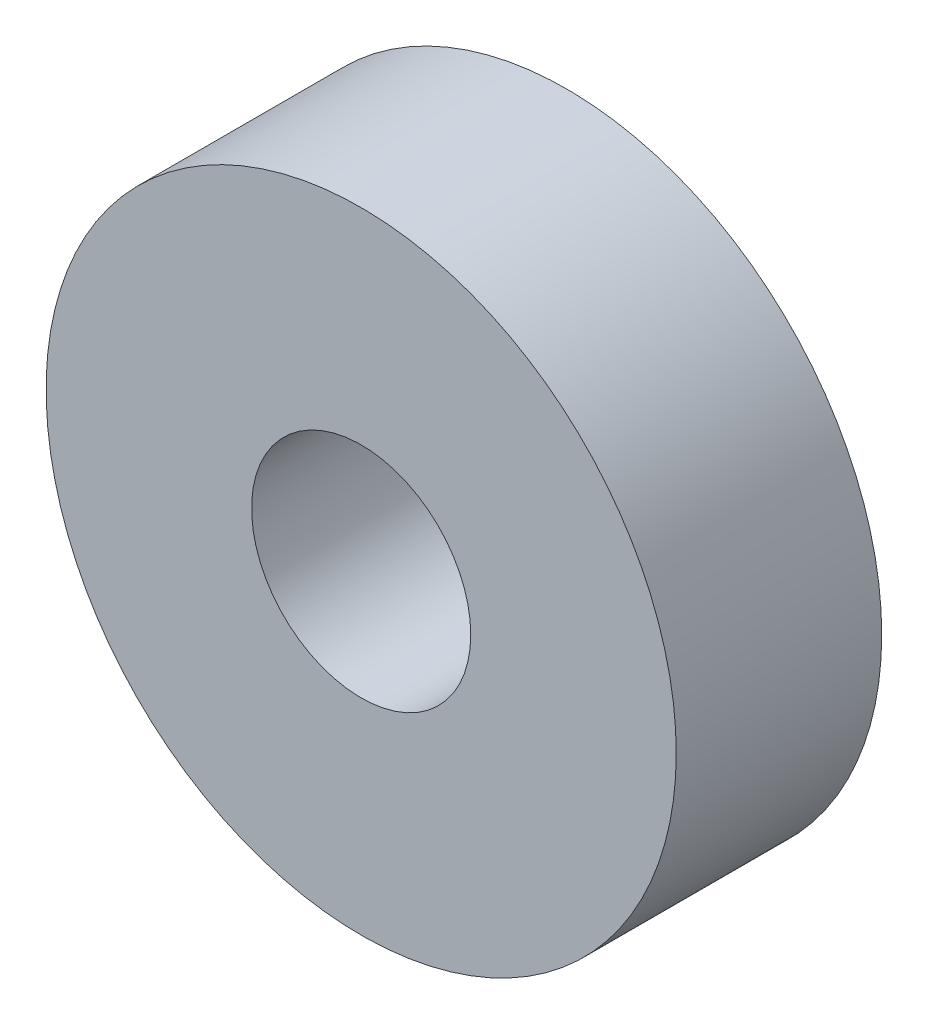
from build123d import *

# Parameters (mm, degrees)
SKETCH1_R           = 4.6
SKETCH1_R_2         = 1.6
BOSS_EXTRUDE1_DEPTH = 3


with BuildPart() as part:
    # Sketch1 → Boss-Extrude1 (new body)
    with BuildSketch(Plane.XY):
        Circle(SKETCH1_R)
        Circle(SKETCH1_R_2, mode=Mode.SUBTRACT)
    extrude(amount=BOSS_EXTRUDE1_DEPTH)


solid = part.part
